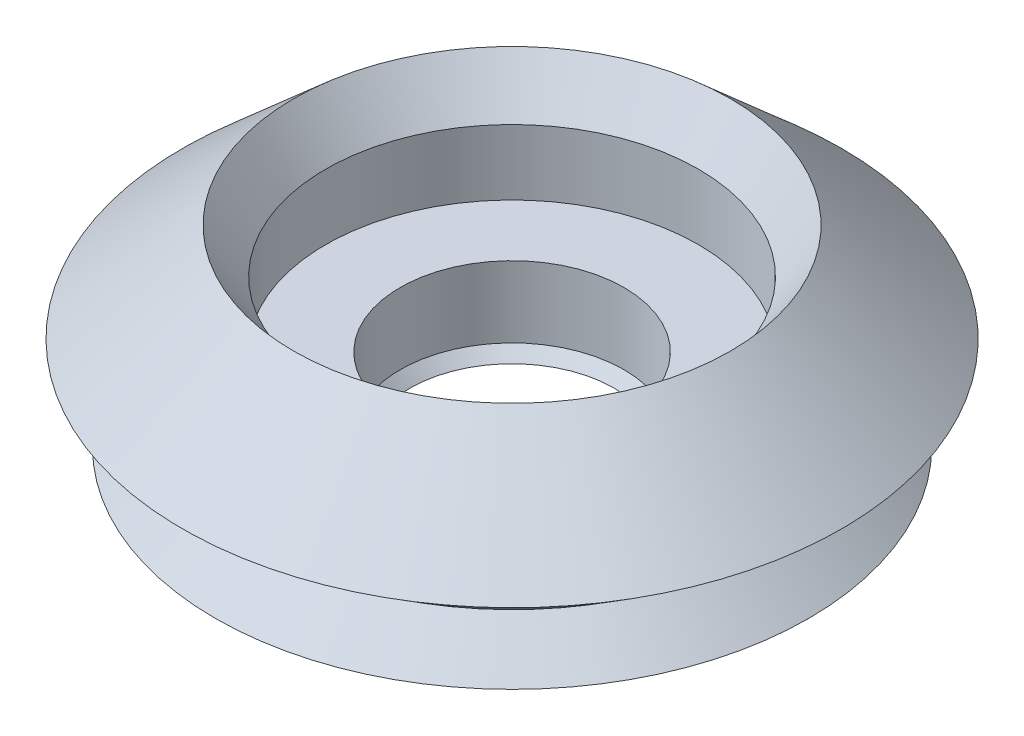
from build123d import *


with BuildPart() as part:
    # Sketch1 → Revolve1 (revolve)
    with BuildSketch(Plane.XY, mode=Mode.PRIVATE) as revolve1_sk:
        Polygon((-20.847188607, 0), (-20.847188607, 13.258811954), (-34.689721841, 13.258811954), (-34.689721841, 25.4335701), (-40.69371216, 33.772445543), (-61.374123258, 15.426919569), (-47.198035005, 5.08671402), (-55.259150264, -2.064275323), (-19.012636009, -2.064275323), align=None)
    revolve(revolve1_sk.sketch.rotate(Axis((0, 0, 0), (0, 1, 0)), 270), axis=Axis((0, 0, 0), (0, 1, 0)))


solid = part.part
